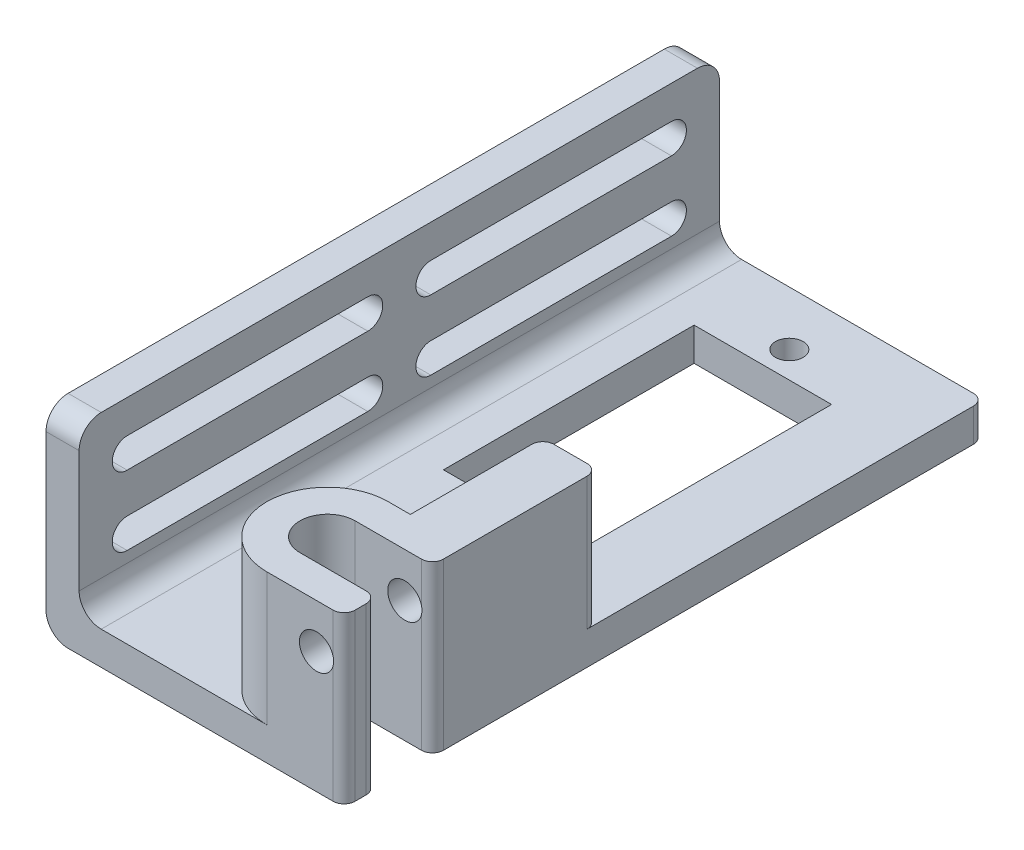
from build123d import *

# Parameters (mm, degrees)
BOSS_EXTRUDE1_DEPTH = 3
SKETCH2_R           = 1.25
SKETCH2_W           = 12.45
SKETCH2_H           = 22.7
CUT_EXTRUDE1_DEPTH  = 3
SKETCH3_W           = 3
SKETCH3_H           = 58
BOSS_EXTRUDE2_DEPTH = 15
BOSS_EXTRUDE3_DEPTH = 12
FILLET1_R           = 2
FILLET2_R           = 2
FILLET3_R           = 1
CUT_EXTRUDE2_DEPTH  = 3
SKETCH7_R           = 1.55
CUT_EXTRUDE3_DEPTH  = 48.728398255


with BuildPart() as part:
    # Sketch1 → Boss-Extrude1 (new body)
    with BuildSketch(Plane(origin=(0, 0, 0), x_dir=(1, 0, 0), z_dir=(0, 1, 0))):
        with BuildLine():
            Line((27, 8), (20, 8))
            ThreePointArc((20, 8), (17.5, 5.5), (20, 3))
            Line((20, 3), (27, 3))
            Line((27, 3), (27, 0))
            Line((27, 0), (0, 0))
            Line((0, 0), (0, 58))
            Line((0, 58), (27, 58))
            Line((27, 58), (27, 8))
        make_face()
    extrude(amount=BOSS_EXTRUDE1_DEPTH)

    # Sketch2 → Cut-Extrude1 (cut)
    with BuildSketch(Plane(origin=(0, 3, 0), x_dir=(1, 0, 0), z_dir=(0, 1, 0))):
        with Locations(Location((14.225, 53.1, 0), (0, 0, 270))):
            Circle(SKETCH2_R)
        with Locations(Location((14.225, 25.6, 0), (0, 0, 270))):
            Circle(SKETCH2_R)
        with Locations((14.225, 39.35)):
            Rectangle(SKETCH2_W, SKETCH2_H)
    extrude(amount=-CUT_EXTRUDE1_DEPTH, mode=Mode.SUBTRACT)

    # Sketch3 → Boss-Extrude2 (add)
    with BuildSketch(Plane(origin=(0, 3, 0), x_dir=(1, 0, 0), z_dir=(0, 1, 0))):
        with Locations((1.5, 29)):
            Rectangle(SKETCH3_W, SKETCH3_H)
    extrude(amount=BOSS_EXTRUDE2_DEPTH)

    # Sketch4 → Boss-Extrude3 (add)
    with BuildSketch(Plane(origin=(0, 3, 0), x_dir=(1, 0, 0), z_dir=(0, 1, 0))):
        with BuildLine():
            Line((20, 11), (22, 11))
            Line((22, 11), (22, 23))
            Line((22, 23), (27, 23))
            Line((27, 23), (27, 11))
            Line((27, 11), (27, 8))
            Line((27, 8), (20, 8))
            ThreePointArc((20, 8), (17.5, 5.5), (20, 3))
            Line((20, 3), (27, 3))
            Line((27, 3), (27, 0))
            Line((27, 0), (20, 0))
            ThreePointArc((20, 0), (14.5, 5.5), (20, 11))
        make_face()
    extrude(amount=BOSS_EXTRUDE3_DEPTH)

    # Fillet1
    fillet1_edges = [part.edges().sort_by_distance(p)[0] for p in [
        (0, 0, -29),
        (3, 3, -29),
    ]]
    fillet(fillet1_edges, radius=FILLET1_R)

    # Fillet2
    fillet2_edges = [part.edges().sort_by_distance(p)[0] for p in [
        (1.5, 18, 0),
        (1.5, 18, -58),
    ]]
    fillet(fillet2_edges, radius=FILLET2_R)

    # Fillet3
    fillet3_edges = [part.edges().sort_by_distance(p)[0] for p in [
        (27, 1.5, -58),
        (27, 7.5, -8),
        (27, 7.5, -3),
        (27, 7.5, 0),
        (27, 9, -23),
        (22, 9, -23),
    ]]
    fillet(fillet3_edges, radius=FILLET3_R)

    # Sketch5 → Cut-Extrude2 (cut)
    with BuildSketch(Plane.ZY):
        with BuildLine():
            Line((-53.65, 15), (-31.85, 15))
            ThreePointArc((-31.85, 15), (-30.5, 13.65), (-31.85, 12.3))
            Line((-31.85, 12.3), (-53.65, 12.3))
            ThreePointArc((-53.65, 12.3), (-55, 13.65), (-53.65, 15))
        make_face()
        with BuildLine():
            Line((-53.65, 8.7), (-31.85, 8.7))
            ThreePointArc((-31.85, 8.7), (-30.5, 7.35), (-31.85, 6))
            Line((-31.85, 6), (-53.65, 6))
            ThreePointArc((-53.65, 6), (-55, 7.35), (-53.65, 8.7))
        make_face()
        with BuildLine():
            Line((-26.15, 15), (-4.35, 15))
            ThreePointArc((-4.35, 15), (-3, 13.65), (-4.35, 12.3))
            Line((-4.35, 12.3), (-26.15, 12.3))
            ThreePointArc((-26.15, 12.3), (-27.5, 13.65), (-26.15, 15))
        make_face()
        with BuildLine():
            Line((-26.15, 8.7), (-4.35, 8.7))
            ThreePointArc((-4.35, 8.7), (-3, 7.35), (-4.35, 6))
            Line((-4.35, 6), (-26.15, 6))
            ThreePointArc((-26.15, 6), (-27.5, 7.35), (-26.15, 8.7))
        make_face()
    extrude(amount=-CUT_EXTRUDE2_DEPTH, mode=Mode.SUBTRACT)

    # Sketch7 → Cut-Extrude3 (cut, through all)
    with BuildSketch(Plane(origin=(0, 0, -23), x_dir=(-1, 0, 0), z_dir=(0, 0, -1))):
        with Locations(Location((-24.5, 11, 0), (0, 0, 165.407449398))):
            Circle(SKETCH7_R)
    extrude(amount=-CUT_EXTRUDE3_DEPTH, mode=Mode.SUBTRACT)


solid = part.part
